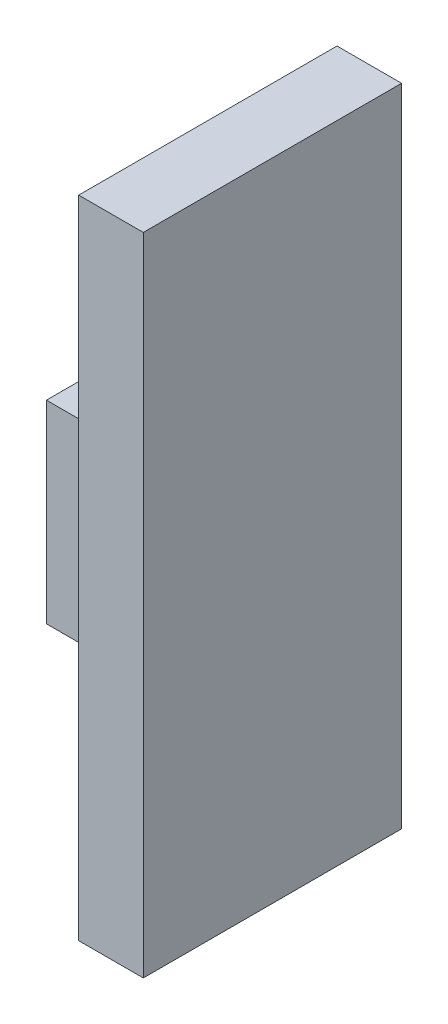
from build123d import *

# Parameters (mm, degrees)
SKETCH1_W           = 40
SKETCH1_H           = 100
BOSS_EXTRUDE1_DEPTH = 10
SKETCH2_W           = 30
SKETCH2_H           = 30
BOSS_EXTRUDE2_DEPTH = 10
SKETCH3_R           = 10
CUT_EXTRUDE1_DEPTH  = 10


with BuildPart() as part:
    # Sketch1 → Boss-Extrude1 (new body)
    with BuildSketch(Plane(origin=(0, 0, 0), x_dir=(0, 0, -1), z_dir=(1, 0, 0))):
        Rectangle(SKETCH1_W, SKETCH1_H)
    extrude(amount=BOSS_EXTRUDE1_DEPTH)

    # Sketch2 → Boss-Extrude2 (add)
    with BuildSketch(Plane.ZY):
        Rectangle(SKETCH2_W, SKETCH2_H)
    extrude(amount=BOSS_EXTRUDE2_DEPTH)

    # Sketch3 → Cut-Extrude1 (cut)
    with BuildSketch(Plane.ZY.offset(10)):
        Circle(SKETCH3_R)
    extrude(amount=-CUT_EXTRUDE1_DEPTH, mode=Mode.SUBTRACT)


solid = part.part
